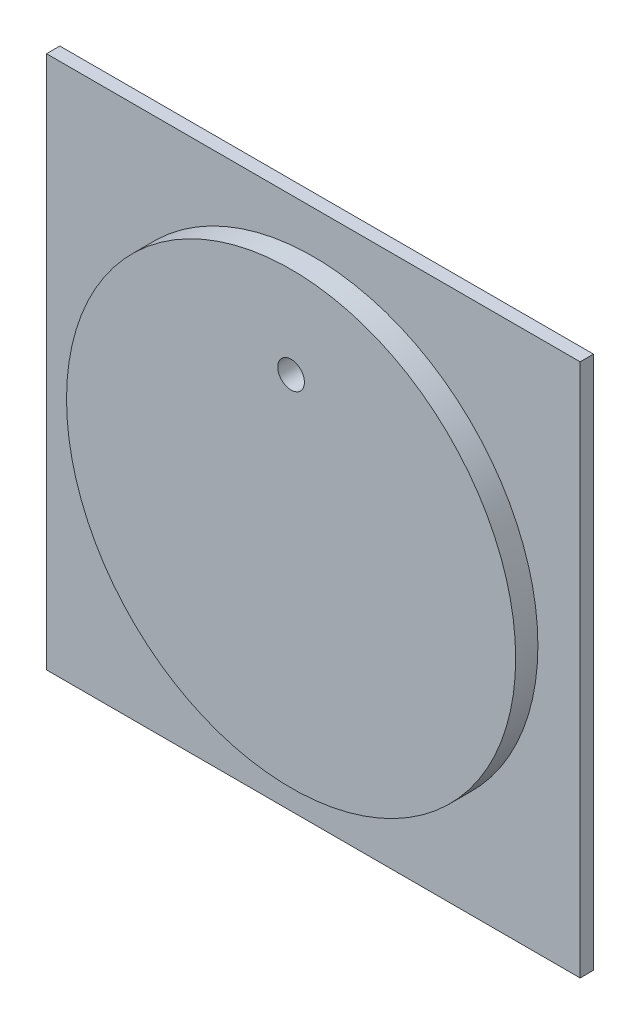
from build123d import *

# Parameters (mm, degrees)
SKETCH1_R           = 25.25
BOSS_EXTRUDE1_DEPTH = 4
SKETCH1_4_W         = 60
SKETCH1_4_H         = 60
SKETCH1_4_R         = 25.25
BOSS_EXTRUDE2_DEPTH = 1.5
SKETCH2_R           = 1.5
CUT_EXTRUDE1_DEPTH  = 43.614551505


with BuildPart() as part:
    # Sketch1 → Boss-Extrude1 (new body)
    with BuildSketch(Plane.XY):
        Circle(SKETCH1_R)
    extrude(amount=BOSS_EXTRUDE1_DEPTH)

    # Sketch1<4> → Boss-Extrude2 (add)
    with BuildSketch(Plane.XY):
        Rectangle(SKETCH1_4_W, SKETCH1_4_H)
        Circle(SKETCH1_4_R, mode=Mode.SUBTRACT)
    extrude(amount=BOSS_EXTRUDE2_DEPTH)

    # Sketch2 → Cut-Extrude1 (cut, through all)
    with BuildSketch(Plane.XY.offset(4)):
        with Locations((0, 15)):
            Circle(SKETCH2_R)
    extrude(amount=-CUT_EXTRUDE1_DEPTH, mode=Mode.SUBTRACT)


solid = part.part
